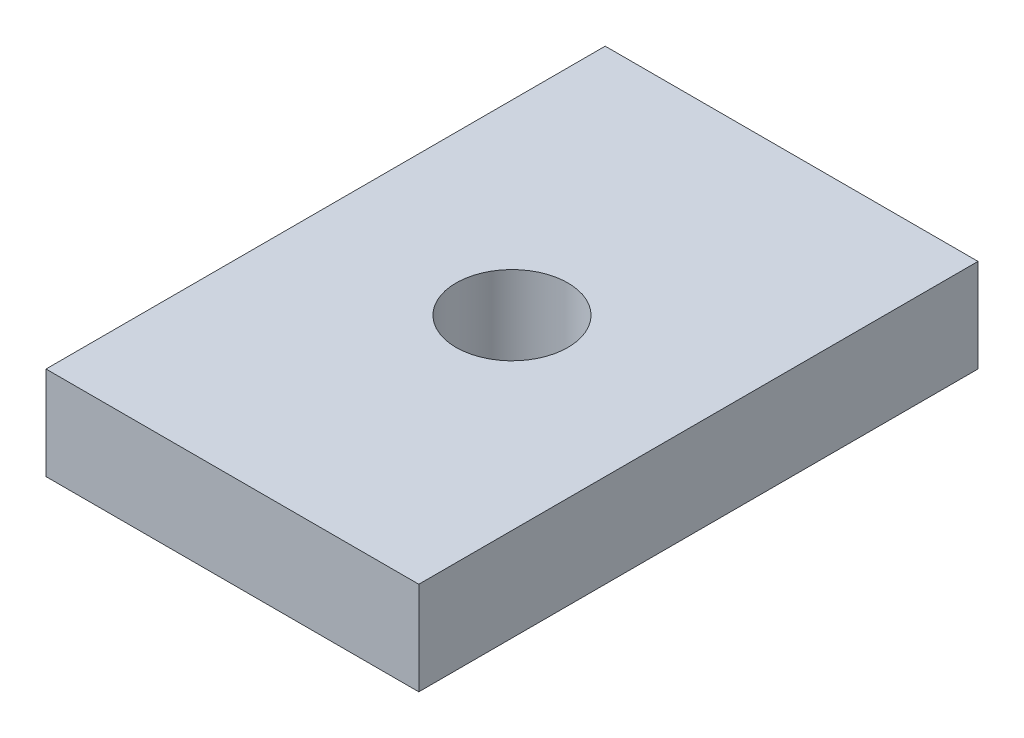
from build123d import *

# Parameters (mm, degrees)
SKETCH1_W           = 20
SKETCH1_H           = 30
SKETCH1_R           = 3
BOSS_EXTRUDE1_DEPTH = 5


with BuildPart() as part:
    # Sketch1 → Boss-Extrude1 (new body)
    with BuildSketch(Plane(origin=(0, 0, 0), x_dir=(1, 0, 0), z_dir=(0, 1, 0))):
        Rectangle(SKETCH1_W, SKETCH1_H)
        with Locations(Location((0, 0, 0), (0, 0, 270))):
            Circle(SKETCH1_R, mode=Mode.SUBTRACT)
    extrude(amount=BOSS_EXTRUDE1_DEPTH)


solid = part.part
